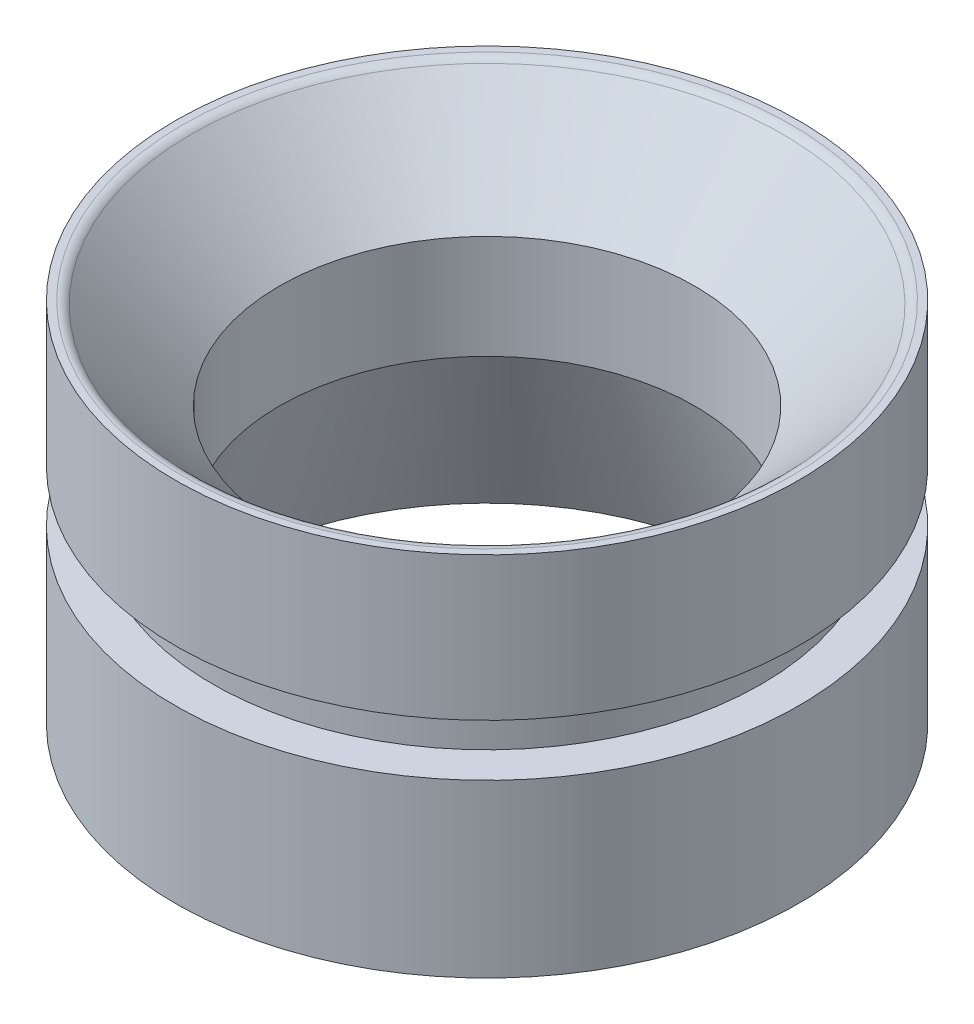
from build123d import *

# Parameters (mm, degrees)
FILLET3_R = 0.762


with BuildPart() as part:
    # Sketch1 → Revolve1 (revolve)
    with BuildSketch(Plane.XY, mode=Mode.PRIVATE) as revolve1_sk:
        Polygon((12.7, -3.175), (12.7, 3.175), (18.288, 8.763), (19.05, 8.763), (19.05, 0), (16.764, 0), (16.764, -3.175), (19.05, -3.175), (19.05, -13.642888968), (16.51, -13.642888968), align=None)
    revolve(revolve1_sk.sketch.rotate(Axis((0, 44.779079664, 0), (0, -1, 0)), 180), axis=Axis((0, 44.779079664, 0), (0, -1, 0)))

    # Fillet3
    fillet3_edges = [part.edges().sort_by_distance(p)[0] for p in [
        (18.288, 8.763, 0),
    ]]
    fillet(fillet3_edges, radius=FILLET3_R)


solid = part.part
